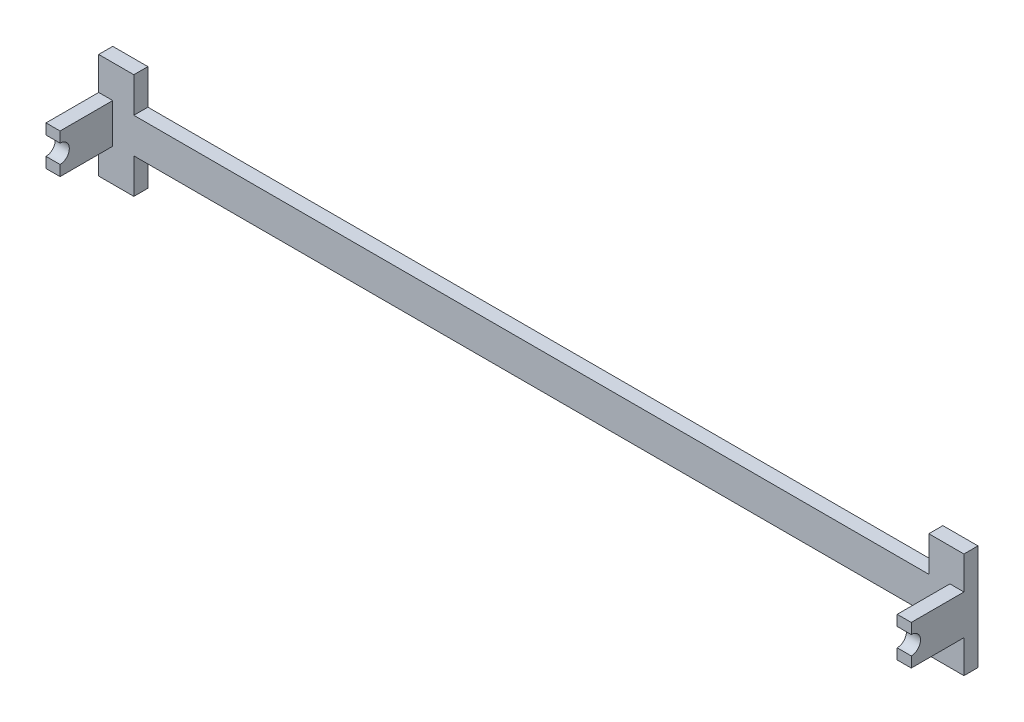
from build123d import *

# Parameters (mm, degrees)
EXTRUDE_START   = -15
SKETCH_1_W      = 246.3
SKETCH_1_H      = 10
EXTRUDE_1_DEPTH = 4
SKETCH_2_W      = 10
SKETCH_2_H      = 30
EXTRUDE_2_DEPTH = 4
EXTRUDE_3_DEPTH = 4
EXTRUDE_START_2 = -4
EXTRUDE_4_DEPTH = 4


with BuildPart() as part:
    # 草图1 → 凸台-拉伸1 (new body)
    with BuildSketch(Plane.XY.offset(EXTRUDE_START)):
        with Locations((109.15, 0)):
            Rectangle(SKETCH_1_W, SKETCH_1_H)
    extrude(amount=-EXTRUDE_1_DEPTH)

    # 草图2 → 凸台-拉伸2 (add)
    with BuildSketch(Plane(origin=(0, 0, -19), x_dir=(-1, 0, 0), z_dir=(0, 0, -1))):
        with Locations((9, 0)):
            Rectangle(SKETCH_2_W, SKETCH_2_H)
        with Locations((-227.3, 0)):
            Rectangle(SKETCH_2_W, SKETCH_2_H)
    extrude(amount=-EXTRUDE_2_DEPTH)

    # 草图4 → 凸台-拉伸3 (add)
    with BuildSketch(Plane(origin=(232.3, 0, 0), x_dir=(0, 0, -1), z_dir=(1, 0, 0))):
        with BuildLine():
            Line((0, -2.63), (0, -5.63))
            Line((0, -5.63), (15, -5.63))
            Line((15, -5.63), (15, 5.63))
            Line((15, 5.63), (0, 5.63))
            Line((0, 5.63), (0, 2.63))
            ThreePointArc((0, 2.63), (2.63, 0), (0, -2.63))
        make_face()
    extrude(amount=-EXTRUDE_3_DEPTH)

    # 草图5 → 凸台-拉伸4 (add)
    with BuildSketch(Plane.ZY.offset(14).offset(EXTRUDE_START_2)):
        with BuildLine():
            Line((0, 2.63), (0, 5.63))
            Line((0, 5.63), (-15, 5.63))
            Line((-15, 5.63), (-15, -5.63))
            Line((-15, -5.63), (0, -5.63))
            Line((0, -5.63), (0, -2.63))
            ThreePointArc((0, -2.63), (-2.63, 0), (0, 2.63))
        make_face()
    extrude(amount=EXTRUDE_4_DEPTH)


solid = part.part
